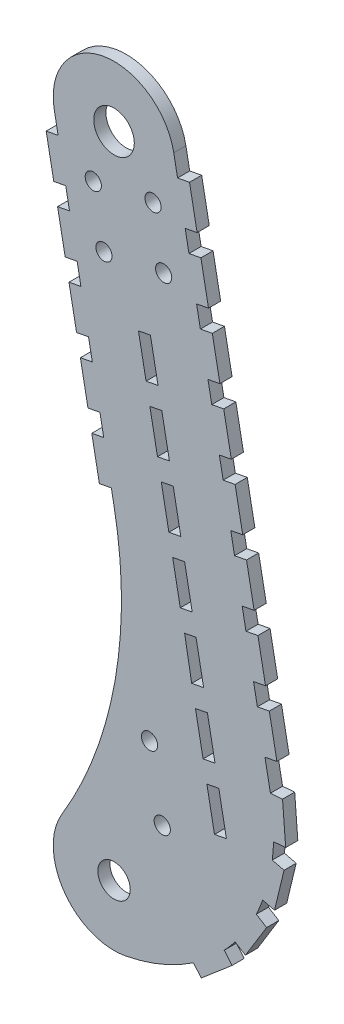
from build123d import *

# Parameters (mm, degrees)
SKETCH_1_R          = 4
EXTRUDE_1_DEPTH     = 3
SKETCH_3_W          = 3
SKETCH_3_H          = 10
EXTRUDE_2_DEPTH     = 3
EXTRUDE_START       = -3
EXTRUDE_3_DEPTH     = 3
SKETCH_6_W          = 3
SKETCH_6_H          = 10
EXTRUDE_4_DEPTH     = 3
SKETCH_9_R          = 2
CUT_EXTRUDE_1_DEPTH = 3
CUT_EXTRUDE_2_DEPTH = 3
SKETCH_11_R         = 2
CUT_EXTRUDE_3_DEPTH = 10
SKETCH_12_R         = 5
CUT_EXTRUDE_4_DEPTH = 10


with BuildPart() as part:
    # 草图1 → 凸台-拉伸1 (new body)
    with BuildSketch(Plane.XY):
        with BuildLine():
            Line((-14.733969043, 77.1875), (0, 0))
            ThreePointArc((0, 0), (0.234014868, -37.324654706), (-12.859683228, -72.278047703))
            ThreePointArc((-12.859683228, -72.278047703), (-12.300551756, -88.584662282), (2.8125, -94.733969043))
            ThreePointArc((2.8125, -94.733969043), (31.596681738, -75.82131672), (38.576907128, -42.094561915))
            Line((38.576907128, -42.094561915), (14.733969043, 82.8125))
            ThreePointArc((14.733969043, 82.8125), (-2.8125, 94.733969043), (-14.733969043, 77.1875))
        make_face()
        with Locations((0, 80)):
            Circle(SKETCH_1_R, mode=Mode.SUBTRACT)
        with Locations((0, -80)):
            Circle(SKETCH_1_R, mode=Mode.SUBTRACT)
    extrude(amount=EXTRUDE_1_DEPTH)

    # 草图3 → 凸台-拉伸2 (add)
    with BuildSketch(Plane(origin=(29.467938085, 5.625, 0), x_dir=(0, 0, -1), z_dir=(0.9822646028438571, 0.18749999999999992, 0))):
        with Locations((-1.5, 68.581168228)):
            Rectangle(SKETCH_3_W, SKETCH_3_H)
        with Locations((-1.5, 53.581168228)):
            Rectangle(SKETCH_3_W, SKETCH_3_H)
        with Locations((-1.5, 38.581168228)):
            Rectangle(SKETCH_3_W, SKETCH_3_H)
        with Locations((-1.5, 23.581168228)):
            Rectangle(SKETCH_3_W, SKETCH_3_H)
        with Locations((-1.5, 8.581168228)):
            Rectangle(SKETCH_3_W, SKETCH_3_H)
        with Locations((-1.5, -6.418831772)):
            Rectangle(SKETCH_3_W, SKETCH_3_H)
        with Locations((-1.5, -21.418831772)):
            Rectangle(SKETCH_3_W, SKETCH_3_H)
        with Locations((-1.5, -36.418831772)):
            Rectangle(SKETCH_3_W, SKETCH_3_H)
    extrude(amount=EXTRUDE_2_DEPTH)

    # 草图5 → 凸台-拉伸3 (add)
    with BuildSketch(Plane.XY.offset(3).offset(EXTRUDE_START)):
        with BuildLine():
            Line((41.937087865, -56.870590681), (39.020842697, -56.166663045))
            ThreePointArc((39.020842697, -56.166663045), (38.118677527, -61.090976463), (36.675111125, -65.884605639))
            Line((36.675111125, -65.884605639), (39.591356294, -66.588533275))
            Line((39.591356294, -66.588533275), (41.937087865, -56.870590681))
        make_face()
        with BuildLine():
            ThreePointArc((36.675111125, -65.884605639), (38.118677527, -61.090976463), (39.020842697, -56.166663045))
            Line((39.020842697, -56.166663045), (31.045751878, -56.518626863))
            Line((31.045751878, -56.518626863), (36.675111125, -65.884605639))
        make_face()
        with BuildLine():
            Line((35.852417991, -52.061745464), (39.348993243, -52.061745464))
            ThreePointArc((39.348993243, -52.061745464), (39.240593596, -47.056646648), (38.576907128, -42.094561915))
            Line((38.576907128, -42.094561915), (35.852417991, -52.061745464))
        make_face()
        with BuildLine():
            ThreePointArc((38.576907128, -42.094561915), (39.240593596, -47.056646648), (39.348993243, -52.061745464))
            Line((39.348993243, -52.061745464), (42.340032816, -51.830051112))
            Line((42.340032816, -51.830051112), (41.567946701, -41.862867564))
            Line((41.567946701, -41.862867564), (38.576907128, -42.094561915))
        make_face()
        with BuildLine():
            ThreePointArc((29.860599408, -78.204651867), (32.714825521, -74.091726153), (35.094532117, -69.687210158))
            Line((35.094532117, -69.687210158), (30.758010447, -62.472220292))
            Line((30.758010447, -62.472220292), (29.860599408, -78.204651867))
        make_face()
        with BuildLine():
            Line((37.650520485, -71.25785444), (35.094532117, -69.687210158))
            ThreePointArc((35.094532117, -69.687210158), (32.714825521, -74.091726153), (29.860599408, -78.204651867))
            Line((29.860599408, -78.204651867), (32.416587776, -79.775296149))
            Line((32.416587776, -79.775296149), (37.650520485, -71.25785444))
        make_face()
        with BuildLine():
            ThreePointArc((19.572509978, -87.815912184), (23.558004264, -84.786291758), (27.182310023, -81.332717899))
            Line((27.182310023, -81.332717899), (19.572509978, -65.497664614))
            Line((19.572509978, -65.497664614), (19.572509978, -87.815912184))
        make_face()
        with BuildLine():
            Line((29.127843641, -83.616333222), (27.182310023, -81.332717899))
            ThreePointArc((27.182310023, -81.332717899), (23.558004264, -84.786291758), (19.572509978, -87.815912184))
            Line((19.572509978, -87.815912184), (21.518043596, -90.099527507))
            Line((21.518043596, -90.099527507), (29.127843641, -83.616333222))
        make_face()
    extrude(amount=EXTRUDE_3_DEPTH)

    # 草图6 → 凸台-拉伸4 (add)
    with BuildSketch(Plane(origin=(0, 0, 0), x_dir=(0, 0, 1), z_dir=(-0.9822646028438571, -0.18749999999999994, 0))):
        with Locations((1.5, 68.581168228)):
            Rectangle(SKETCH_6_W, SKETCH_6_H)
        with Locations((1.5, 53.581168228)):
            Rectangle(SKETCH_6_W, SKETCH_6_H)
        with Locations((1.5, 38.581168228)):
            Rectangle(SKETCH_6_W, SKETCH_6_H)
        with Locations((1.5, 23.581168228)):
            Rectangle(SKETCH_6_W, SKETCH_6_H)
        with Locations((1.5, 8.581168228)):
            Rectangle(SKETCH_6_W, SKETCH_6_H)
    extrude(amount=EXTRUDE_4_DEPTH)

    # 草图9 → 切除-拉伸1 (cut)
    with BuildSketch(Plane.XY.offset(3)):
        with Locations((11.891030957, -62.294073604)):
            Circle(SKETCH_9_R)
        with Locations((8.750405957, -45.841141506)):
            Circle(SKETCH_9_R)
    extrude(amount=-CUT_EXTRUDE_1_DEPTH, mode=Mode.SUBTRACT)

    # 草图10 → 切除-拉伸2 (cut)
    with BuildSketch(Plane.XY.offset(3)):
        Polygon((7.5, 40.709415886), (8.973396904, 40.990665886), (10.848396904, 31.168019858), (7.901603096, 30.605519858), (6.026603096, 40.428165886), align=None)
        Polygon((10.3125, 25.975446844), (11.785896904, 26.256696844), (13.660896904, 16.434050815), (10.714103096, 15.871550815), (8.839103096, 25.694196844), align=None)
        Polygon((13.125, 11.241477801), (14.598396904, 11.522727801), (16.473396904, 1.700081772), (13.526603096, 1.137581772), (11.651603096, 10.960227801), align=None)
        Polygon((15.9375, -3.492491242), (17.410896904, -3.211241242), (19.285896904, -13.03388727), (16.339103096, -13.59638727), (14.464103096, -3.773741242), align=None)
        Polygon((18.75, -18.226460284), (20.223396904, -17.945210284), (22.098396904, -27.767856313), (19.151603096, -28.330356313), (17.410896904, -18.482075553), align=None)
        Polygon((21.5625, -32.960429327), (23.035896904, -32.679179327), (24.910896904, -42.501825355), (21.964103096, -43.064325355), (20.089103096, -33.241679327), align=None)
        Polygon((24.375, -47.69439837), (25.848396904, -47.41314837), (27.723396904, -57.235794398), (24.776603096, -57.798294398), (22.901603096, -47.97564837), align=None)
    extrude(amount=-CUT_EXTRUDE_2_DEPTH, mode=Mode.SUBTRACT)

    # 草图11 → 切除-拉伸3 (cut)
    with BuildSketch(Plane.XY.offset(3)):
        with Locations((9.616984521, 69.619074766)):
            Circle(SKETCH_11_R)
        with Locations((12.241984521, 55.867370326)):
            Circle(SKETCH_11_R)
        with Locations((-5.116984521, 66.806574766)):
            Circle(SKETCH_11_R)
        with Locations((-2.491984521, 53.054870326)):
            Circle(SKETCH_11_R)
    extrude(amount=-CUT_EXTRUDE_3_DEPTH, mode=Mode.SUBTRACT)

    # 草图12 → 切除-拉伸4 (cut)
    with BuildSketch(Plane.XY.offset(3)):
        with Locations((0, 80)):
            Circle(SKETCH_12_R)
    extrude(amount=-CUT_EXTRUDE_4_DEPTH, mode=Mode.SUBTRACT)


solid = part.part
